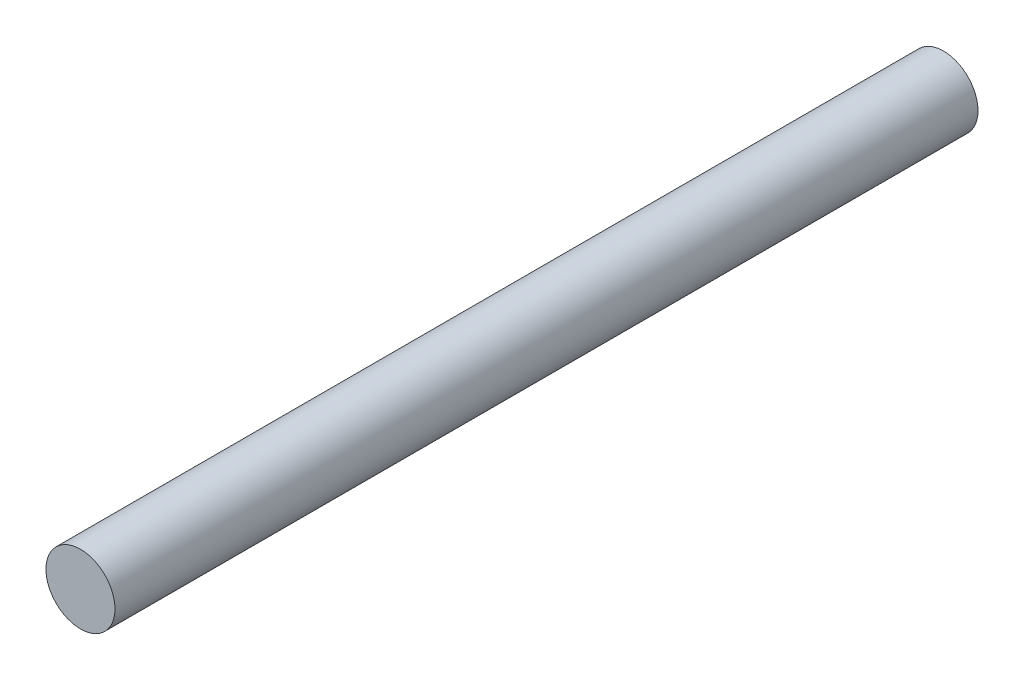
from build123d import *

# Parameters (mm, degrees)
SKETCH1_R           = 4
BOSS_EXTRUDE1_DEPTH = 100


with BuildPart() as part:
    # Sketch1 → Boss-Extrude1 (new body)
    with BuildSketch(Plane.XY):
        with Locations((-5.987136889, 4.964489284)):
            Circle(SKETCH1_R)
    extrude(amount=BOSS_EXTRUDE1_DEPTH)


solid = part.part
